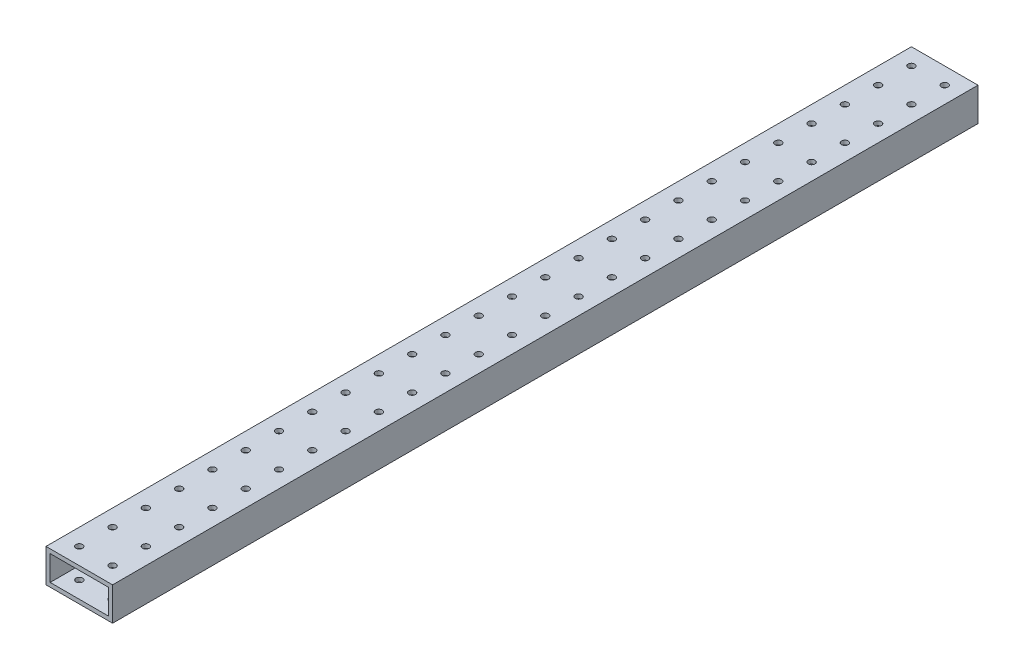
from build123d import *

# Parameters (mm, degrees)
SKETCH1_W           = 50.8
SKETCH1_H           = 25.4
BOSS_EXTRUDE1_DEPTH = 660.4
SKETCH2_W           = 44.45
SKETCH2_H           = 19.05
CUT_EXTRUDE1_DEPTH  = 660.4
SKETCH3_R           = 2.54
CUT_EXTRUDE2_DEPTH  = 25.4


with BuildPart() as part:
    # Sketch1 → Boss-Extrude1 (new body)
    with BuildSketch(Plane.XY):
        with Locations((-12.7, -0.789265537)):
            Rectangle(SKETCH1_W, SKETCH1_H)
    extrude(amount=BOSS_EXTRUDE1_DEPTH)

    # Sketch2 → Cut-Extrude1 (cut)
    with BuildSketch(Plane.XY.offset(660.4)):
        with Locations((-12.7, -0.789265537)):
            Rectangle(SKETCH2_W, SKETCH2_H)
    extrude(amount=-CUT_EXTRUDE1_DEPTH, mode=Mode.SUBTRACT)

    # Sketch3 → Cut-Extrude2 (cut)
    with BuildSketch(Plane(origin=(0, 11.910734463, 0), x_dir=(1, 0, 0), z_dir=(0, 1, 0))):
        with Locations(Location((-25.4, -647.7, 0), (0, 0, 270))):
            Circle(SKETCH3_R)
        with Locations(Location((0, -647.7, 0), (0, 0, 270))):
            Circle(SKETCH3_R)
        with Locations(Location((0, -622.3, 0), (0, 0, 270))):
            Circle(SKETCH3_R)
        with Locations(Location((0, -596.9, 0), (0, 0, 270))):
            Circle(SKETCH3_R)
        with Locations(Location((0, -571.5, 0), (0, 0, 270))):
            Circle(SKETCH3_R)
        with Locations(Location((0, -546.1, 0), (0, 0, 270))):
            Circle(SKETCH3_R)
        with Locations(Location((0, -520.7, 0), (0, 0, 270))):
            Circle(SKETCH3_R)
        with Locations(Location((0, -495.3, 0), (0, 0, 270))):
            Circle(SKETCH3_R)
        with Locations(Location((0, -469.9, 0), (0, 0, 270))):
            Circle(SKETCH3_R)
        with Locations(Location((0, -444.5, 0), (0, 0, 270))):
            Circle(SKETCH3_R)
        with Locations(Location((0, -419.1, 0), (0, 0, 270))):
            Circle(SKETCH3_R)
        with Locations(Location((0, -393.7, 0), (0, 0, 270))):
            Circle(SKETCH3_R)
        with Locations(Location((0, -368.3, 0), (0, 0, 270))):
            Circle(SKETCH3_R)
        with Locations(Location((0, -342.9, 0), (0, 0, 270))):
            Circle(SKETCH3_R)
        with Locations(Location((0, -317.5, 0), (0, 0, 270))):
            Circle(SKETCH3_R)
        with Locations(Location((0, -292.1, 0), (0, 0, 270))):
            Circle(SKETCH3_R)
        with Locations(Location((0, -266.7, 0), (0, 0, 270))):
            Circle(SKETCH3_R)
        with Locations(Location((0, -241.3, 0), (0, 0, 270))):
            Circle(SKETCH3_R)
        with Locations(Location((0, -215.9, 0), (0, 0, 270))):
            Circle(SKETCH3_R)
        with Locations(Location((0, -190.5, 0), (0, 0, 270))):
            Circle(SKETCH3_R)
        with Locations(Location((0, -165.1, 0), (0, 0, 270))):
            Circle(SKETCH3_R)
        with Locations(Location((0, -139.7, 0), (0, 0, 270))):
            Circle(SKETCH3_R)
        with Locations(Location((0, -114.3, 0), (0, 0, 270))):
            Circle(SKETCH3_R)
        with Locations(Location((0, -88.9, 0), (0, 0, 270))):
            Circle(SKETCH3_R)
        with Locations(Location((0, -63.5, 0), (0, 0, 270))):
            Circle(SKETCH3_R)
        with Locations(Location((0, -38.1, 0), (0, 0, 270))):
            Circle(SKETCH3_R)
        with Locations(Location((0, -12.7, 0), (0, 0, 270))):
            Circle(SKETCH3_R)
        with Locations(Location((-25.4, -622.3, 0), (0, 0, 270))):
            Circle(SKETCH3_R)
        with Locations(Location((-25.4, -596.9, 0), (0, 0, 270))):
            Circle(SKETCH3_R)
        with Locations(Location((-25.4, -571.5, 0), (0, 0, 270))):
            Circle(SKETCH3_R)
        with Locations(Location((-25.4, -546.1, 0), (0, 0, 270))):
            Circle(SKETCH3_R)
        with Locations(Location((-25.4, -520.7, 0), (0, 0, 270))):
            Circle(SKETCH3_R)
        with Locations(Location((-25.4, -495.3, 0), (0, 0, 270))):
            Circle(SKETCH3_R)
        with Locations(Location((-25.4, -469.9, 0), (0, 0, 270))):
            Circle(SKETCH3_R)
        with Locations(Location((-25.4, -444.5, 0), (0, 0, 270))):
            Circle(SKETCH3_R)
        with Locations(Location((-25.4, -419.1, 0), (0, 0, 270))):
            Circle(SKETCH3_R)
        with Locations(Location((-25.4, -393.7, 0), (0, 0, 270))):
            Circle(SKETCH3_R)
        with Locations(Location((-25.4, -368.3, 0), (0, 0, 270))):
            Circle(SKETCH3_R)
        with Locations(Location((-25.4, -342.9, 0), (0, 0, 270))):
            Circle(SKETCH3_R)
        with Locations(Location((-25.4, -317.5, 0), (0, 0, 270))):
            Circle(SKETCH3_R)
        with Locations(Location((-25.4, -292.1, 0), (0, 0, 270))):
            Circle(SKETCH3_R)
        with Locations(Location((-25.4, -266.7, 0), (0, 0, 270))):
            Circle(SKETCH3_R)
        with Locations(Location((-25.4, -241.3, 0), (0, 0, 270))):
            Circle(SKETCH3_R)
        with Locations(Location((-25.4, -215.9, 0), (0, 0, 270))):
            Circle(SKETCH3_R)
        with Locations(Location((-25.4, -190.5, 0), (0, 0, 270))):
            Circle(SKETCH3_R)
        with Locations(Location((-25.4, -165.1, 0), (0, 0, 270))):
            Circle(SKETCH3_R)
        with Locations(Location((-25.4, -139.7, 0), (0, 0, 270))):
            Circle(SKETCH3_R)
        with Locations(Location((-25.4, -114.3, 0), (0, 0, 270))):
            Circle(SKETCH3_R)
        with Locations(Location((-25.4, -88.9, 0), (0, 0, 270))):
            Circle(SKETCH3_R)
        with Locations(Location((-25.4, -63.5, 0), (0, 0, 270))):
            Circle(SKETCH3_R)
        with Locations(Location((-25.4, -38.1, 0), (0, 0, 270))):
            Circle(SKETCH3_R)
        with Locations(Location((-25.4, -12.7, 0), (0, 0, 270))):
            Circle(SKETCH3_R)
    extrude(amount=-CUT_EXTRUDE2_DEPTH, mode=Mode.SUBTRACT)


solid = part.part
